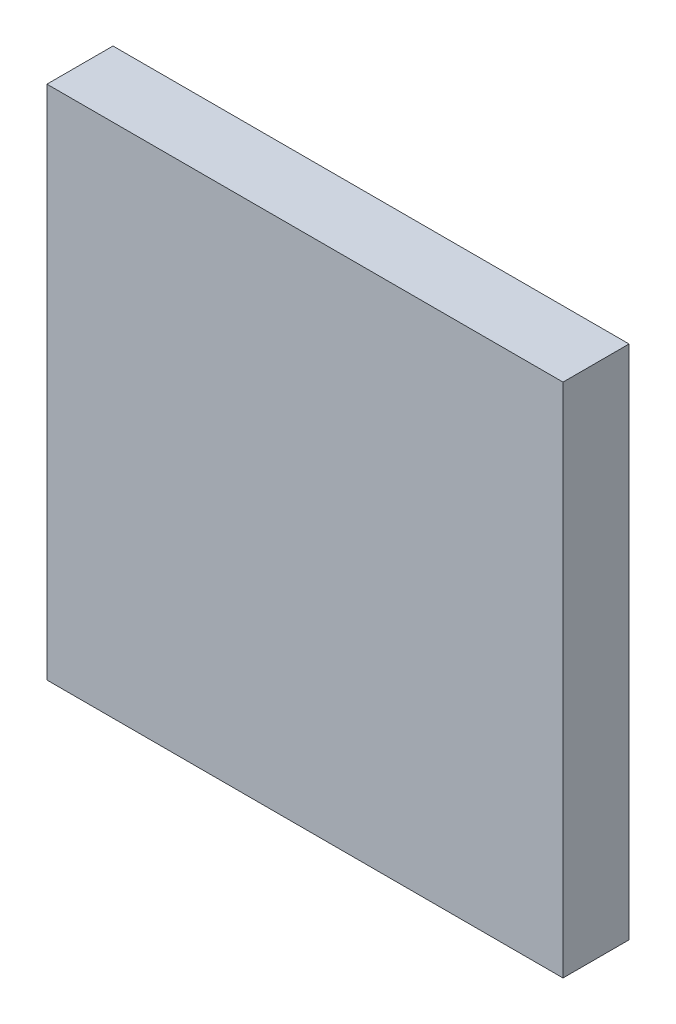
from build123d import *

# Parameters (mm, degrees)
SKETCH1_W           = 125
SKETCH1_H           = 125
BOSS_EXTRUDE1_DEPTH = 16


with BuildPart() as part:
    # Sketch1 → Boss-Extrude1 (new body)
    with BuildSketch(Plane.XY):
        with Locations((62.5, 62.5)):
            Rectangle(SKETCH1_W, SKETCH1_H)
    extrude(amount=BOSS_EXTRUDE1_DEPTH)


solid = part.part
